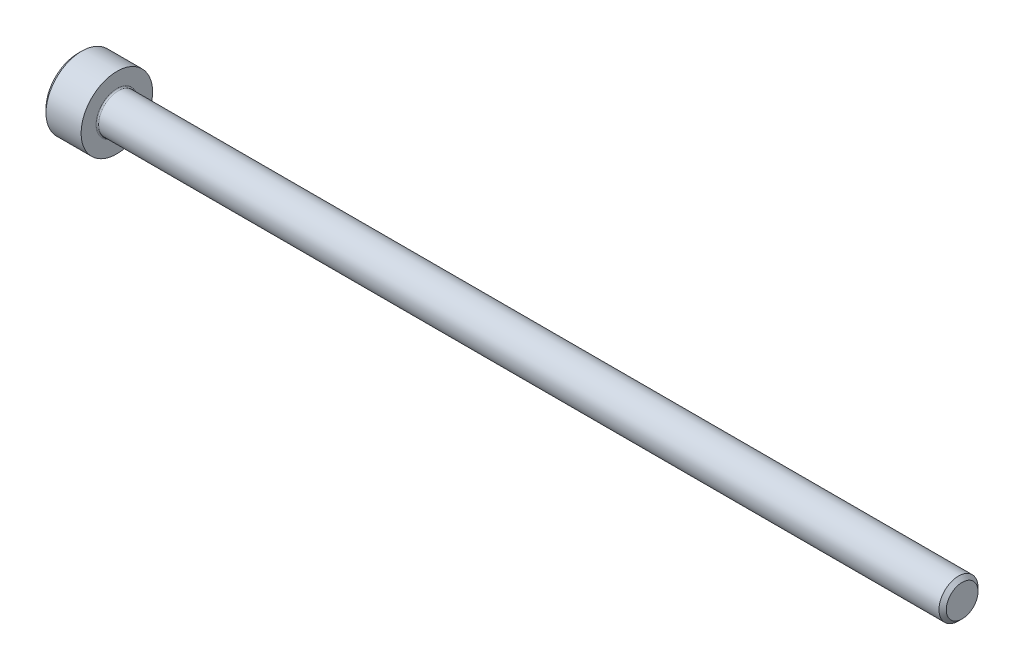
from build123d import *

# Parameters (mm, degrees)
FILLET1_R   = 0.1
HEX_2_DEPTH = 1.3


with BuildPart() as part:
    # BodySke → Base-Revolve (revolve)
    with BuildSketch(Plane.XY, mode=Mode.PRIVATE) as base_revolve_sk:
        Polygon((0, 0), (0, 2.45), (0.3, 2.75), (3, 2.75), (3, 1.5), (67.7195, 1.5), (68, 1.2195), (68, 0), align=None)
    revolve(base_revolve_sk.sketch.rotate(Axis((-31.75, 0, 0), (1, 0, 0)), 90), axis=Axis((-31.75, 0, 0), (1, 0, 0)))

    # Fillet1
    fillet1_edges = [part.edges().sort_by_distance(p)[0] for p in [
        (3, 0, -1.5),
    ]]
    fillet(fillet1_edges, radius=FILLET1_R)

    # Sketch2 → Hex-PreBroach (revolve, cut)
    with BuildSketch(Plane.XY, mode=Mode.PRIVATE) as hex_prebroach_sk:
        Polygon((0, 1.28), (1.3, 1.28), (2.039008345, 0), (0, 0), align=None)
    revolve(hex_prebroach_sk.sketch.rotate(Axis((0, 0, 0), (1, 0, 0)), 90), axis=Axis((0, 0, 0), (1, 0, 0)), mode=Mode.SUBTRACT)

    # Sketch3 → Hex 2 (cut)
    with BuildSketch(Plane(origin=(0, 0, 0), x_dir=(0, 0.500000000000001, 0.866025403784438), z_dir=(-1, 0, 0))):
        Polygon((0.739008345, 1.28), (-0.739008345, 1.28), (-1.478016689, 0), (-0.739008345, -1.28), (0.739008345, -1.28), (1.478016689, 0), align=None)
    extrude(amount=-HEX_2_DEPTH, mode=Mode.SUBTRACT)


solid = part.part
